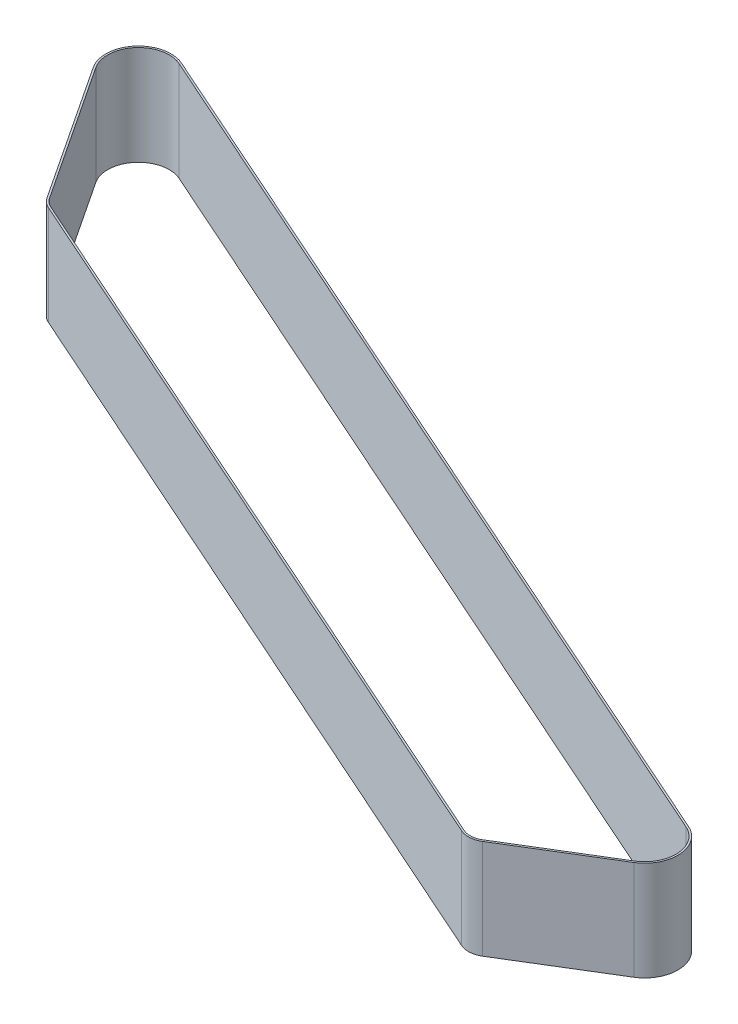
from build123d import *

# Parameters (mm, degrees)
EXTRUDE_1_DEPTH = 54


with BuildPart() as part:
    # 草图1 → 凸台-拉伸1 (new body)
    with BuildSketch(Plane(origin=(0, 0, 0), x_dir=(1, 0, 0), z_dir=(0, 1, 0))):
        with BuildLine():
            ThreePointArc((-224.091230242, 162.375487068), (-244.806924848, 157.652626052), (-246.078397413, 136.443458772))
            Line((-246.078397413, 136.443458772), (-197.199257089, 62.405433085))
            ThreePointArc((-197.199257089, 62.405433085), (-195.041572593, 59.971891729), (-192.288857087, 58.239759155))
            Line((-192.288857087, 58.239759155), (213.190233659, -122.721502411))
            ThreePointArc((213.190233659, -122.721502411), (218.617938967, -123.695981456), (223.875273721, -122.031642066))
            Line((223.875273721, -122.031642066), (274.861498447, -90.862018276))
            ThreePointArc((274.861498447, -90.862018276), (283.435193918, -74.339940028), (272.79992067, -59.063216341))
            Line((272.79992067, -59.063216341), (-224.091230242, 162.375487068))
        make_face()
        with BuildLine():
            ThreePointArc((-245.243860787, 136.994411239), (-244.044186993, 157.005918262), (-224.498286741, 161.462084086))
            Line((-224.498286741, 161.462084086), (272.392864172, -59.976619323))
            ThreePointArc((272.392864172, -59.976619323), (282.437288906, -74.404636139), (274.33990985, -90.008821151))
            Line((274.33990985, -90.008821151), (222.246746967, -121.767406417))
            ThreePointArc((222.246746967, -121.767406417), (217.926670991, -122.719757656), (213.59777898, -121.808317429))
            Line((213.59777898, -121.808317429), (-191.881311765, 59.152944137))
            ThreePointArc((-191.881311765, 59.152944137), (-194.280273175, 60.63880571), (-196.19690286, 62.709875751))
            Line((-196.19690286, 62.709875751), (-245.243860787, 136.994411239))
        make_face(mode=Mode.SUBTRACT)
    extrude(amount=EXTRUDE_1_DEPTH)


solid = part.part
